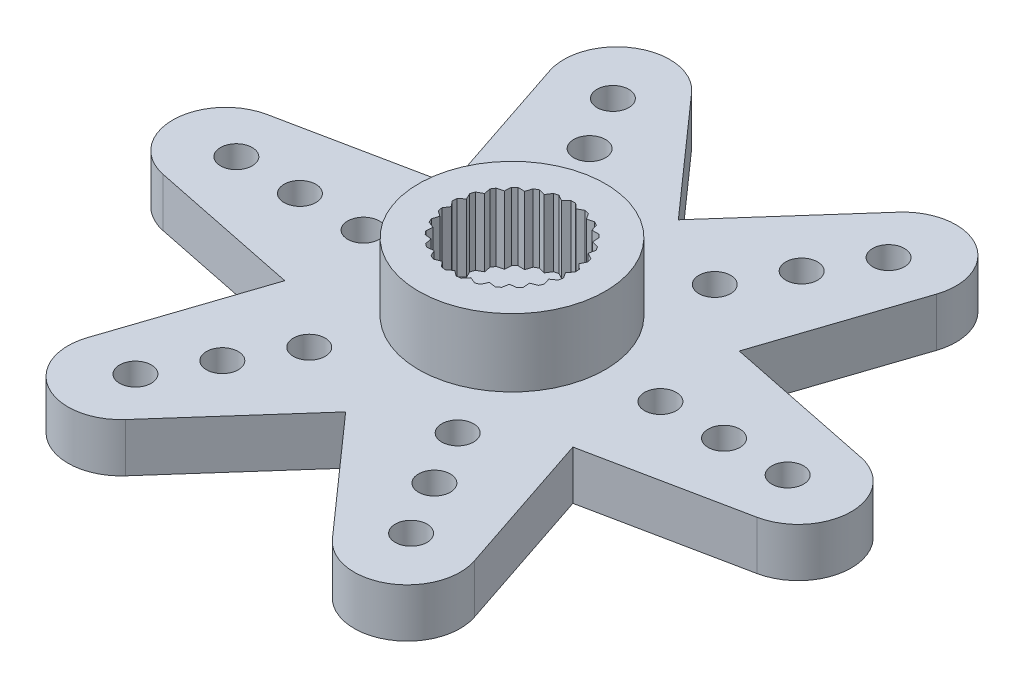
from build123d import *

# Parameters (mm, degrees)
SKETCH2_R           = 6
SKETCH2_R_2         = 1.5
BOSS_EXTRUDE1_DEPTH = 1.15
SKETCH3_R           = 4.4
BOSS_EXTRUDE2_DEPTH = 3.2
SKETCH4_R           = 0.75
BOSS_EXTRUDE3_DEPTH = 1.15
CIRPATTERN1_COUNT   = 6


with BuildPart() as part:
    # Sketch2 → Boss-Extrude1 (new, symmetric)
    with BuildSketch(Plane(origin=(0, 0, 0), x_dir=(1, 0, 0), z_dir=(0, 1, 0))):
        with Locations(Location((0, 0, 0), (0, 0, 270))):
            Circle(SKETCH2_R)
        with Locations(Location((0, 0, 0), (0, 0, 270))):
            Circle(SKETCH2_R_2, mode=Mode.SUBTRACT)
    extrude(amount=BOSS_EXTRUDE1_DEPTH, both=True)

    # Sketch3 → Boss-Extrude2 (add)
    with BuildSketch(Plane(origin=(0, 1.15, 0), x_dir=(1, 0, 0), z_dir=(0, 1, 0))):
        with Locations(Location((0, 0, 0), (0, 0, 270))):
            Circle(SKETCH3_R)
        with BuildLine():
            Line((0.107421435, 2.898009771), (0.338399731, 2.678709694))
            Line((0.338399731, 2.678709694), (0.61665913, 2.83367809))
            ThreePointArc((0.61665913, 2.83367809), (0.721200673, 2.808891167), (0.824752316, 2.780248841))
            Line((0.824752316, 2.780248841), (0.993936292, 2.510396512))
            Line((0.993936292, 2.510396512), (1.301992734, 2.591295993))
            ThreePointArc((1.301992734, 2.591295993), (1.397085655, 2.541289372), (1.490260976, 2.48779465))
            Line((1.490260976, 2.48779465), (1.587020181, 2.184345885))
            Line((1.587020181, 2.184345885), (1.905517346, 2.186093238))
            ThreePointArc((1.905517346, 2.186093238), (1.985186607, 2.11400902), (2.062131058, 2.039023173))
            Line((2.062131058, 2.039023173), (2.080385755, 1.721044772))
            Line((2.080385755, 1.721044772), (2.389311295, 1.643530205))
            ThreePointArc((2.389311295, 1.643530205), (2.448550984, 1.553897705), (2.504429862, 1.46213237))
            Line((2.504429862, 1.46213237), (2.443033042, 1.149604087))
            Line((2.443033042, 1.149604087), (2.722976028, 0.997698125))
            ThreePointArc((2.722976028, 0.997698125), (2.758063897, 0.896149284), (2.789366126, 0.793370413))
            Line((2.789366126, 0.793370413), (2.652175577, 0.505929549))
            Line((2.652175577, 0.505929549), (2.885546163, 0.289177003))
            ThreePointArc((2.885546163, 0.289177003), (2.894277512, 0.182092507), (2.899036259, 0.074758075))
            Line((2.899036259, 0.074758075), (2.694672167, -0.169534403))
            Line((2.694672167, -0.169534403), (2.866806821, -0.437514174))
            ThreePointArc((2.866806821, -0.437514174), (2.848633027, -0.543405812), (2.826549281, -0.648551587))
            Line((2.826549281, -0.648551587), (2.567852594, -0.834345885))
            Line((2.567852594, -0.834345885), (2.667935462, -1.136714727))
            ThreePointArc((2.667935462, -1.136714727), (2.623998452, -1.234759946), (2.576459817, -1.331110368))
            Line((2.576459817, -1.331110368), (2.279685399, -1.446732346))
            Line((2.279685399, -1.446732346), (2.301427906, -1.764491312))
            ThreePointArc((2.301427906, -1.764491312), (2.234488404, -1.84852957), (2.164481907, -1.930030589))
            Line((2.164481907, -1.930030589), (1.848277186, -1.968215294))
            Line((1.848277186, -1.968215294), (1.790313171, -2.281398419))
            ThreePointArc((1.790313171, -2.281398419), (1.704577232, -2.346149284), (1.616501638, -2.40767989))
            Line((1.616501638, -2.40767989), (1.30073492, -2.366028036))
            Line((1.30073492, -2.366028036), (1.166706475, -2.654956874))
            ThreePointArc((1.166706475, -2.654956874), (1.067561203, -2.696351809), (0.966950626, -2.734045809))
            Line((0.966950626, -2.734045809), (0.671462695, -2.615174535))
            Line((0.671462695, -2.615174535), (0.469791321, -2.861694623))
            ThreePointArc((0.469791321, -2.861694623), (0.363466377, -2.877132634), (0.25664255, -2.888621575))
            Line((0.25664255, -2.888621575), (0, -2.7))
            Line((0, -2.7), (-0.25664255, -2.888621575))
            ThreePointArc((-0.25664255, -2.888621575), (-0.363466377, -2.877132634), (-0.469791321, -2.861694623))
            Line((-0.469791321, -2.861694623), (-0.671462695, -2.615174535))
            Line((-0.671462695, -2.615174535), (-0.966950626, -2.734045809))
            ThreePointArc((-0.966950626, -2.734045809), (-1.067561203, -2.696351809), (-1.166706475, -2.654956874))
            Line((-1.166706475, -2.654956874), (-1.30073492, -2.366028036))
            Line((-1.30073492, -2.366028036), (-1.616501638, -2.40767989))
            ThreePointArc((-1.616501638, -2.40767989), (-1.704577232, -2.346149284), (-1.790313171, -2.281398419))
            Line((-1.790313171, -2.281398419), (-1.848277186, -1.968215294))
            Line((-1.848277186, -1.968215294), (-2.164481907, -1.930030589))
            ThreePointArc((-2.164481907, -1.930030589), (-2.234488404, -1.84852957), (-2.301427906, -1.764491312))
            Line((-2.301427906, -1.764491312), (-2.279685399, -1.446732346))
            Line((-2.279685399, -1.446732346), (-2.576459817, -1.331110368))
            ThreePointArc((-2.576459817, -1.331110368), (-2.623998452, -1.234759946), (-2.667935462, -1.136714727))
            Line((-2.667935462, -1.136714727), (-2.567852594, -0.834345885))
            Line((-2.567852594, -0.834345885), (-2.826549281, -0.648551587))
            ThreePointArc((-2.826549281, -0.648551587), (-2.848633027, -0.543405812), (-2.866806821, -0.437514174))
            Line((-2.866806821, -0.437514174), (-2.694672167, -0.169534403))
            Line((-2.694672167, -0.169534403), (-2.899036259, 0.074758075))
            ThreePointArc((-2.899036259, 0.074758075), (-2.894277512, 0.182092507), (-2.885546163, 0.289177003))
            Line((-2.885546163, 0.289177003), (-2.652175577, 0.505929549))
            Line((-2.652175577, 0.505929549), (-2.789366126, 0.793370413))
            ThreePointArc((-2.789366126, 0.793370413), (-2.758063897, 0.896149284), (-2.722976028, 0.997698125))
            Line((-2.722976028, 0.997698125), (-2.443033042, 1.149604087))
            Line((-2.443033042, 1.149604087), (-2.504429862, 1.46213237))
            ThreePointArc((-2.504429862, 1.46213237), (-2.448550984, 1.553897705), (-2.389311295, 1.643530205))
            Line((-2.389311295, 1.643530205), (-2.080385755, 1.721044772))
            Line((-2.080385755, 1.721044772), (-2.062131058, 2.039023173))
            ThreePointArc((-2.062131058, 2.039023173), (-1.985186607, 2.11400902), (-1.905517346, 2.186093238))
            Line((-1.905517346, 2.186093238), (-1.587020181, 2.184345885))
            Line((-1.587020181, 2.184345885), (-1.490260976, 2.48779465))
            ThreePointArc((-1.490260976, 2.48779465), (-1.397085655, 2.541289372), (-1.301992734, 2.591295993))
            Line((-1.301992734, 2.591295993), (-0.993936292, 2.510396512))
            Line((-0.993936292, 2.510396512), (-0.824752316, 2.780248841))
            ThreePointArc((-0.824752316, 2.780248841), (-0.721200673, 2.808891167), (-0.61665913, 2.83367809))
            Line((-0.61665913, 2.83367809), (-0.338399731, 2.678709694))
            Line((-0.338399731, 2.678709694), (-0.107421435, 2.898009771))
            ThreePointArc((-0.107421435, 2.898009771), (0, 2.9), (0.107421435, 2.898009771))
        make_face(mode=Mode.SUBTRACT)
    extrude(amount=BOSS_EXTRUDE2_DEPTH)

    # Sketch4 → Boss-Extrude3 (add, symmetric)
    with BuildSketch(Plane(origin=(0, 0, 0), x_dir=(1, 0, 0), z_dir=(0, 1, 0))):
        with BuildLine():
            Line((3.968626967, 4.5), (14.000671478, 2.449352582))
            ThreePointArc((14.000671478, 2.449352582), (16, 0), (14.000671478, -2.449352582))
            Line((14.000671478, -2.449352582), (3.968626967, -4.5))
            ThreePointArc((3.968626967, -4.5), (6, 0), (3.968626967, 4.5))
        make_face()
        with Locations(Location((13, 0, 0), (0, 0, 270))):
            Circle(SKETCH4_R, mode=Mode.SUBTRACT)
        with Locations(Location((10, 0, 0), (0, 0, 270))):
            Circle(SKETCH4_R, mode=Mode.SUBTRACT)
        with Locations(Location((7, 0, 0), (0, 0, 270))):
            Circle(SKETCH4_R, mode=Mode.SUBTRACT)
    boss_extrude3 = extrude(amount=BOSS_EXTRUDE3_DEPTH, both=True)

    # CirPattern1: Boss-Extrude3 ×6 about axis
    cirpattern1_axis = Axis((0, 0, 0), (0, 1, 0))
    for i in range(1, CIRPATTERN1_COUNT):
        add(boss_extrude3.rotate(cirpattern1_axis, i * 360 / CIRPATTERN1_COUNT))


solid = part.part
